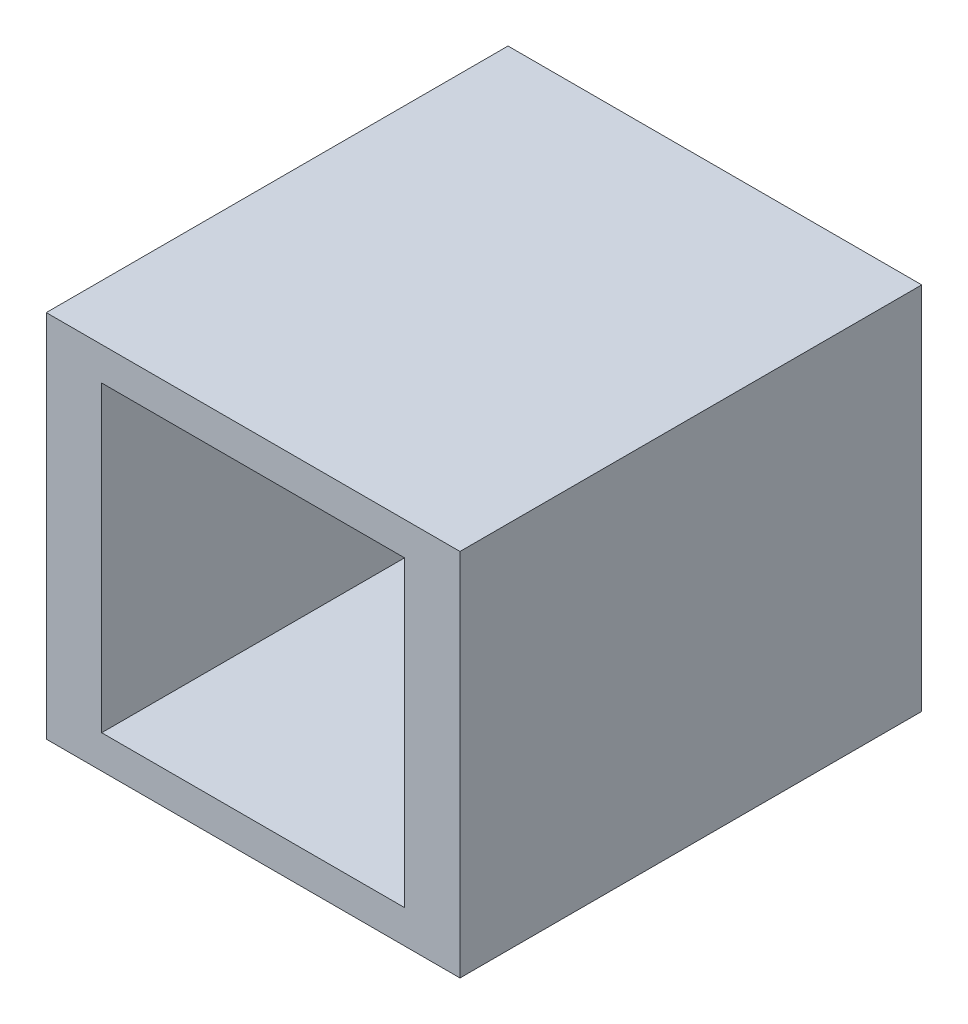
from build123d import *

# Parameters (mm, degrees)
SKETCH_1_W      = 22.4
SKETCH_1_H      = 20
SKETCH_1_W_2    = 16.4
SKETCH_1_H_2    = 16.4
EXTRUDE_1_DEPTH = 20
SKETCH_1_8_W    = 22.4
SKETCH_1_8_H    = 20
EXTRUDE_2_DEPTH = 5


with BuildPart() as part:
    # 草图1 → 凸台-拉伸1 (new body)
    with BuildSketch(Plane.XY):
        Rectangle(SKETCH_1_W, SKETCH_1_H)
        Rectangle(SKETCH_1_W_2, SKETCH_1_H_2, mode=Mode.SUBTRACT)
    extrude(amount=EXTRUDE_1_DEPTH)

    # 草图1<8> → 凸台-拉伸2 (add)
    with BuildSketch(Plane.XY):
        Rectangle(SKETCH_1_8_W, SKETCH_1_8_H)
    extrude(amount=-EXTRUDE_2_DEPTH)


solid = part.part
